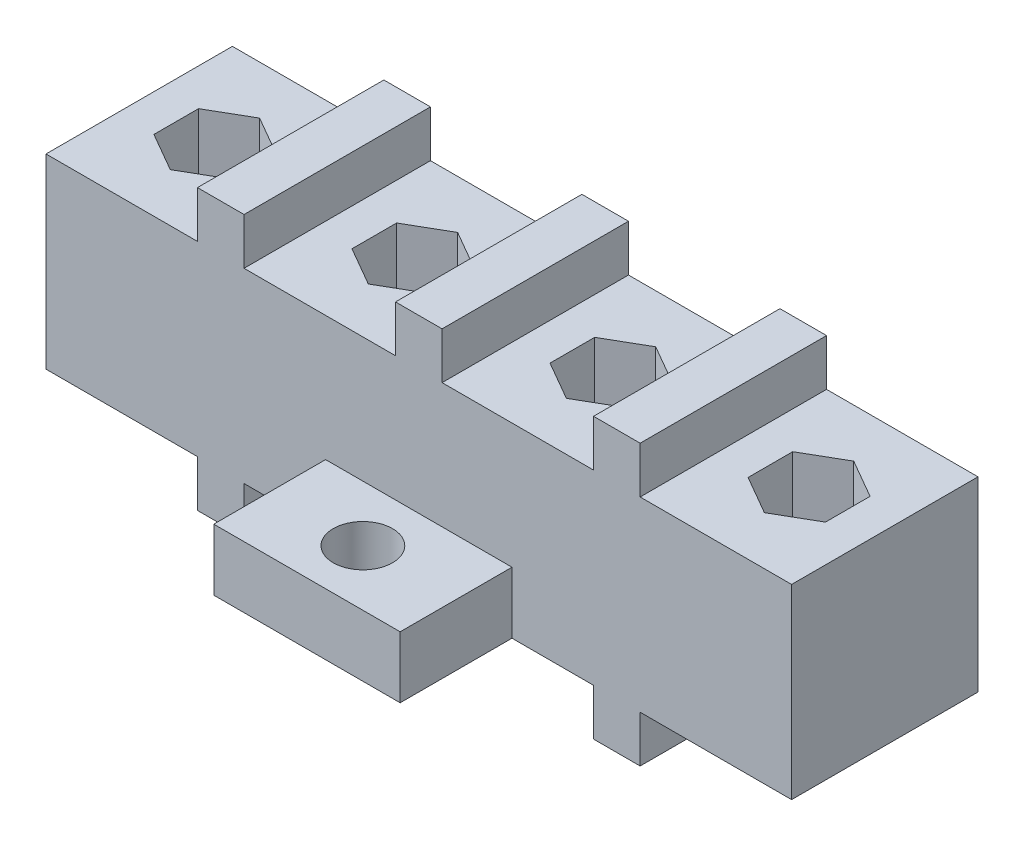
from build123d import *

# Parameters (mm, degrees)
SKETCH1_W               = 50.8
SKETCH1_H               = 12.7
BOSS_EXTRUDE1_DEPTH     = 6.35
SKETCH9_W               = 3.175
SKETCH9_H               = 12.7
BOSS_EXTRUDE3_DEPTH     = 3.175
LPATTERN1_COUNT         = 3
LPATTERN1_PITCH         = 13.49375
MIRROR2_COPY_1_SKETCH_W = 3.175
MIRROR2_COPY_1_SKETCH_H = 12.7
MIRROR2_COPY_1_DEPTH    = 3.175
MIRROR2_COPY_2_SKETCH_W = 3.175
MIRROR2_COPY_2_SKETCH_H = 12.7
MIRROR2_COPY_2_DEPTH    = 3.175
CUT_EXTRUDE1_DEPTH      = 9.525
LPATTERN2_COUNT         = 4
LPATTERN2_PITCH         = 13.49375
F_4_CLEARANCE_HOLE2_D   = 2.9464
LPATTERN3_COUNT         = 4
LPATTERN3_PITCH         = 13.49375
SKETCH13_W              = 12.7
SKETCH13_H              = 4.191
BOSS_EXTRUDE4_DEPTH     = 7.62
HOLE1_D                 = 4.0386


with BuildPart() as part:
    # Sketch1 → Boss-Extrude1 (new, symmetric)
    with BuildSketch(Plane(origin=(0, 0, 0), x_dir=(1, 0, 0), z_dir=(0, 1, 0))):
        Rectangle(SKETCH1_W, SKETCH1_H)
    extrude(amount=BOSS_EXTRUDE1_DEPTH, both=True)

    # Sketch9 → Boss-Extrude3 (add)
    with BuildSketch(Plane(origin=(0, 6.35, 0), x_dir=(1, 0, 0), z_dir=(0, 1, 0))):
        with Locations((-13.49375, 0)):
            Rectangle(SKETCH9_W, SKETCH9_H)
    boss_extrude3 = extrude(amount=BOSS_EXTRUDE3_DEPTH)

    # LPattern1: Boss-Extrude3 ×3
    with Locations(*[(i * LPATTERN1_PITCH, 0, 0) for i in range(1, LPATTERN1_COUNT)]):
        add(boss_extrude3)

    # Mirror2: Boss-Extrude3 across plane
    add(boss_extrude3.mirror(Plane.ZX))

    # Mirror2 copy 1 sketch → Mirror2 copy 1 (add)
    with BuildSketch(Plane(origin=(13.49375, -6.35, 0), x_dir=(1, 0, 0), z_dir=(0, -1, 0))):
        with Locations((-13.49375, 0)):
            Rectangle(MIRROR2_COPY_1_SKETCH_W, MIRROR2_COPY_1_SKETCH_H)
    extrude(amount=MIRROR2_COPY_1_DEPTH)

    # Mirror2 copy 2 sketch → Mirror2 copy 2 (add)
    with BuildSketch(Plane(origin=(26.9875, -6.35, 0), x_dir=(1, 0, 0), z_dir=(0, -1, 0))):
        with Locations((-13.49375, 0)):
            Rectangle(MIRROR2_COPY_2_SKETCH_W, MIRROR2_COPY_2_SKETCH_H)
    extrude(amount=MIRROR2_COPY_2_DEPTH)

    # Sketch10 → Cut-Extrude1 (cut)
    with BuildSketch(Plane(origin=(0, 6.35, 0), x_dir=(1, 0, 0), z_dir=(0, 1, 0))):
        Polygon((-17.605375, 1.521462297), (-20.240625, 3.042924594), (-22.875875, 1.521462297), (-22.875875, -1.521462297), (-20.240625, -3.042924594), (-17.605375, -1.521462297), align=None)
    cut_extrude1 = extrude(amount=-CUT_EXTRUDE1_DEPTH, mode=Mode.SUBTRACT)

    # LPattern2: Cut-Extrude1 ×4
    with Locations(*[(i * LPATTERN2_PITCH, 0, 0) for i in range(1, LPATTERN2_COUNT)]):
        add(cut_extrude1, mode=Mode.SUBTRACT)

    # #4 Clearance Hole2 (through all)
    with Locations(Plane(origin=(0, -3.175, 0), x_dir=(1, 0, 0), z_dir=(0, 1, 0))):
        with Locations((-20.240625, 0)):
            f_4_clearance_hole2 = Hole(F_4_CLEARANCE_HOLE2_D / 2)

    # LPattern3: #4 Clearance Hole2 ×4
    with Locations(*[(i * LPATTERN3_PITCH, 0, 0) for i in range(1, LPATTERN3_COUNT)]):
        add(f_4_clearance_hole2, mode=Mode.SUBTRACT)

    # Sketch13 → Boss-Extrude4 (add)
    with BuildSketch(Plane.XY.offset(6.35)):
        with Locations((0, -4.2545)):
            Rectangle(SKETCH13_W, SKETCH13_H)
    boss_extrude4 = extrude(amount=BOSS_EXTRUDE4_DEPTH)

    # Hole1 (through all)
    with Locations(Plane(origin=(0, -2.159, 0), x_dir=(1, 0, 0), z_dir=(0, 1, 0))):
        with Locations((0, -10.16)):
            hole1 = Hole(HOLE1_D / 2)

    # Mirror4: Boss-Extrude4, Hole1 across plane
    add(boss_extrude4.mirror(Plane.XY))
    add(hole1.mirror(Plane.XY), mode=Mode.SUBTRACT)


solid = part.part
